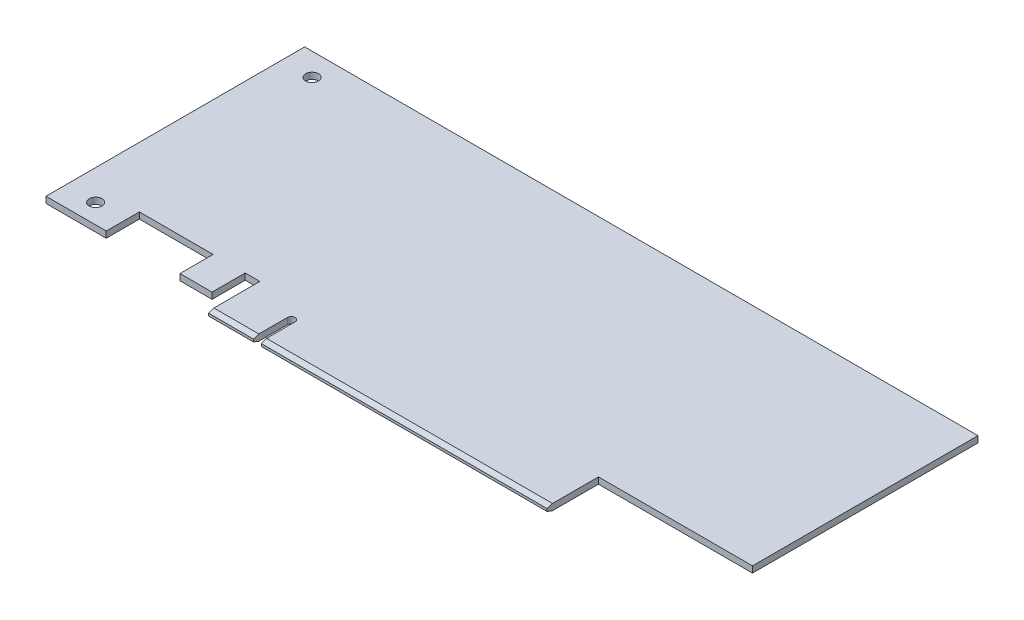
from build123d import *

# Parameters (mm, degrees)
SKETCH_1_R          = 1.59
EXTRUDE_1_DEPTH     = 1.57
CUT_EXTRUDE_1_DEPTH = 84.57


with BuildPart() as part:
    # 草图1 → 凸台-拉伸1 (new body)
    with BuildSketch(Plane(origin=(0, 0, 0), x_dir=(1, 0, 0), z_dir=(0, 1, 0))):
        with BuildLine():
            ThreePointArc((50.6, -0.95), (49.65, 0), (48.7, -0.95))
            Line((48.7, -0.95), (48.7, -9.35))
            Line((48.7, -9.35), (37.5, -9.35))
            Line((37.5, -9.35), (37.5, 3.4))
            Line((37.5, 3.4), (33.85, 3.4))
            Line((33.85, 3.4), (33.85, -4.85))
            Line((33.85, -4.85), (25.85, -4.85))
            Line((25.85, -4.85), (25.85, 3.4))
            Line((25.85, 3.4), (7.5, 3.4))
            Line((7.5, 3.4), (7.5, -4.85))
            Line((7.5, -4.85), (-7.5, -4.85))
            Line((-7.5, -4.85), (-7.5, 4.85))
            Line((-7.5, 4.85), (-7.5, 48.85))
            Line((-7.5, 48.85), (-7.5, 59.55))
            Line((-7.5, 59.55), (160.15, 59.55))
            Line((160.15, 59.55), (160.15, 3.4))
            Line((160.15, 3.4), (121.8, 3.4))
            Line((121.8, 3.4), (121.8, -9.35))
            Line((121.8, -9.35), (50.6, -9.35))
            Line((50.6, -9.35), (50.6, -0.95))
        make_face()
        with Locations(Location((0, 53.9, 0), (0, 0, 270))):
            Circle(SKETCH_1_R, mode=Mode.SUBTRACT)
        with Locations(Location((0, 0, 0), (0, 0, 270))):
            Circle(SKETCH_1_R, mode=Mode.SUBTRACT)
    extrude(amount=EXTRUDE_1_DEPTH)

    # 草图2 → 切除-拉伸1 (cut)
    with BuildSketch(Plane(origin=(121.8, 0, 0), x_dir=(0, 0, -1), z_dir=(1, 0, 0))):
        Polygon((-9.35, 1.096838695), (-8.05, 1.57), (-9.35, 1.57), align=None)
        Polygon((-8.05, 0), (-9.35, 0.473161305), (-9.35, 0), align=None)
    extrude(amount=-CUT_EXTRUDE_1_DEPTH, mode=Mode.SUBTRACT)


solid = part.part
